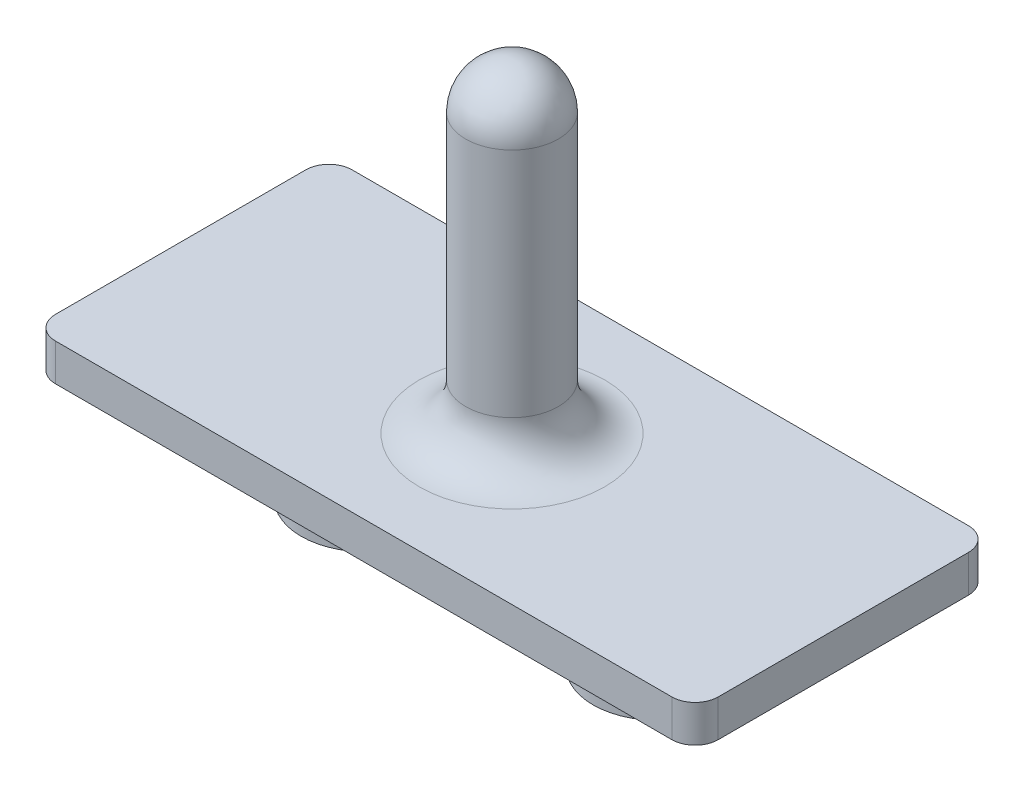
from build123d import *

# Parameters (mm, degrees)
SKETCH1_W           = 36.322
SKETCH1_H           = 16.256
BOSS_EXTRUDE1_DEPTH = 2.032
SKETCH2_R           = 2.54
BOSS_EXTRUDE2_DEPTH = 17.78
FILLET1_R           = 2.54
FILLET2_R           = 2.54
FILLET3_R           = 1.27
SKETCH3_R           = 3.556
BOSS_EXTRUDE3_DEPTH = 5.08


with BuildPart() as part:
    # Sketch1 → Boss-Extrude1 (new body)
    with BuildSketch(Plane(origin=(0, 0, 0), x_dir=(1, 0, 0), z_dir=(0, 1, 0))):
        with Locations((18.161, -8.128)):
            Rectangle(SKETCH1_W, SKETCH1_H)
    extrude(amount=BOSS_EXTRUDE1_DEPTH)

    # Sketch2 → Boss-Extrude2 (add)
    with BuildSketch(Plane(origin=(0, 2.032, 0), x_dir=(1, 0, 0), z_dir=(0, 1, 0))):
        with Locations(Location((18.161, -8.128, 0), (0, 0, 270))):
            Circle(SKETCH2_R)
    extrude(amount=BOSS_EXTRUDE2_DEPTH)

    # Fillet1
    fillet1_edges = [part.edges().sort_by_distance(p)[0] for p in [
        (18.161, 19.812, 5.588),
    ]]
    fillet(fillet1_edges, radius=FILLET1_R)

    # Fillet2
    fillet2_edges = [part.edges().sort_by_distance(p)[0] for p in [
        (18.161, 2.032, 5.588),
    ]]
    fillet(fillet2_edges, radius=FILLET2_R)

    # Fillet3
    fillet3_edges = [part.edges().sort_by_distance(p)[0] for p in [
        (0, 1.016, 0),
        (36.322, 1.016, 0),
        (36.322, 1.016, 16.256),
        (0, 1.016, 16.256),
    ]]
    fillet(fillet3_edges, radius=FILLET3_R)

    # Sketch3 → Boss-Extrude3 (add)
    with BuildSketch(Plane.XZ):
        with Locations(Location((10.16, 8.128, 0), (0, 0, 90))):
            Circle(SKETCH3_R)
        with Locations(Location((26.162, 8.128, 0), (0, 0, 90))):
            Circle(SKETCH3_R)
    extrude(amount=BOSS_EXTRUDE3_DEPTH)


solid = part.part
